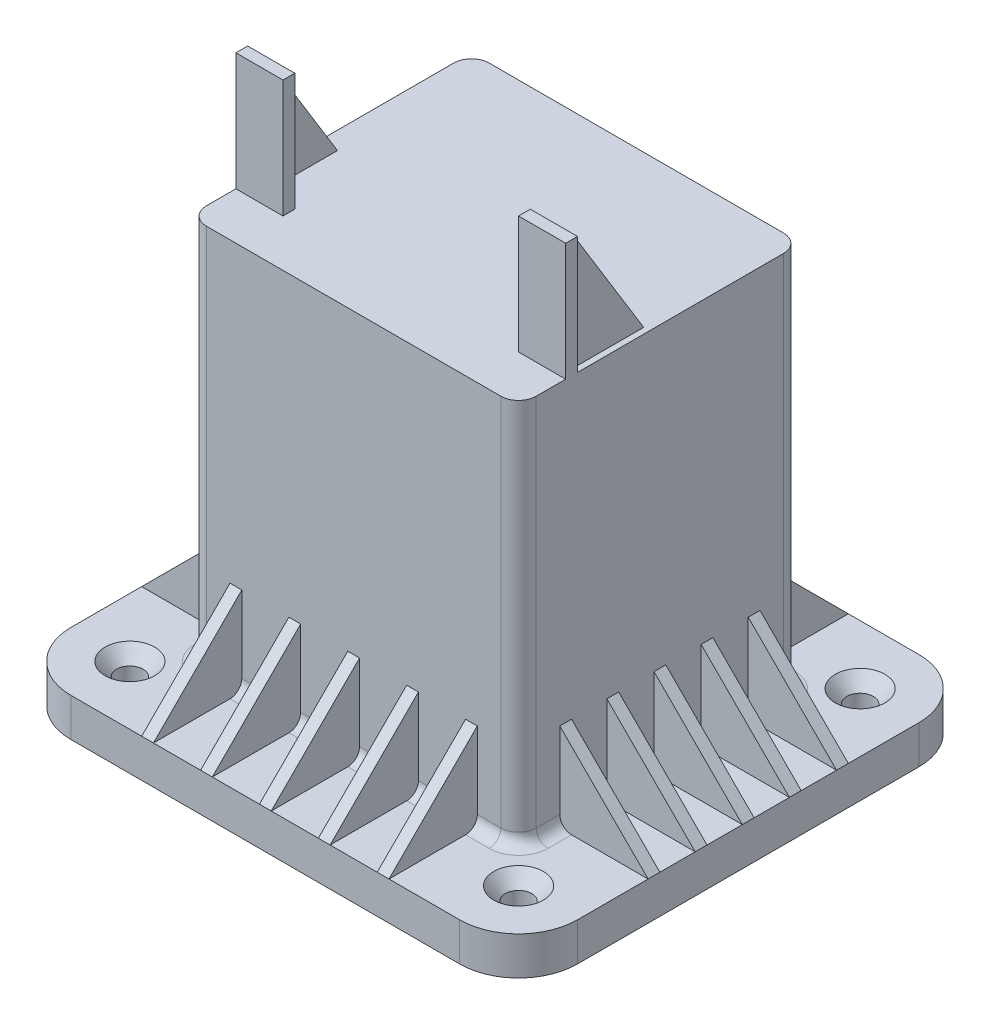
from build123d import *

# Parameters (mm, degrees)
BOSS_EXTRUDE1_DEPTH                            = 8
BOSS_EXTRUDE2_DEPTH                            = 40
SKETCH1_4_W                                    = 8
SKETCH1_4_H                                    = 20
BOSS_EXTRUDE3_DEPTH                            = 2
RIB3_REACH                                     = 72.887
SKETCH3_WALL_W                                 = 167.227880054
SKETCH3_WALL_H                                 = 2
FILLET2_R                                      = 3
BOSS_EXTRUDE4_DEPTH                            = 64
SKETCH5_W                                      = 86
SKETCH5_H                                      = 78
BOSS_EXTRUDE5_DEPTH                            = 6.5
FILLET3_R                                      = 10
CSK_FOR_8_FLAT_HEAD_MACHINE_SCREW1_D           = 4.4958
CSK_FOR_8_FLAT_HEAD_MACHINE_SCREW1_CSINK_D     = 8.4328
CSK_FOR_8_FLAT_HEAD_MACHINE_SCREW1_CSINK_ANGLE = 82
FILLET4_R                                      = 2
RIB4_REACH                                     = 102.29
SKETCH7_WALL_W                                 = 223.792364866
SKETCH7_WALL_H                                 = 2
LPATTERN1_COUNT                                = 3
LPATTERN1_PITCH                                = 10
LPATTERN1_COL_COUNT                            = 3
LPATTERN1_COL_PITCH                            = 10
MIRROR3_COPY_1_REACH                           = 102.29
MIRROR3_COPY_1_SKETCH_W                        = 223.792364866
MIRROR3_COPY_1_SKETCH_H                        = 2
MIRROR3_COPY_2_REACH                           = 102.29
MIRROR3_COPY_2_SKETCH_W                        = 223.792364866
MIRROR3_COPY_2_SKETCH_H                        = 2
MIRROR3_COPY_3_REACH                           = 102.29
MIRROR3_COPY_3_SKETCH_W                        = 223.792364866
MIRROR3_COPY_3_SKETCH_H                        = 2
MIRROR3_COPY_4_REACH                           = 102.29
MIRROR3_COPY_4_SKETCH_W                        = 223.792364866
MIRROR3_COPY_4_SKETCH_H                        = 2
RIB5_REACH                                     = 105.315
SKETCH8_WALL_W                                 = 229.843307728
SKETCH8_WALL_H                                 = 2
LPATTERN2_COUNT                                = 3
LPATTERN2_PITCH                                = 8
LPATTERN2_COL_COUNT                            = 3
LPATTERN2_COL_PITCH                            = 8
MIRROR4_COPY_1_REACH                           = 105.315
MIRROR4_COPY_1_SKETCH_W                        = 229.843307728
MIRROR4_COPY_1_SKETCH_H                        = 2
MIRROR4_COPY_2_REACH                           = 105.315
MIRROR4_COPY_2_SKETCH_W                        = 229.843307728
MIRROR4_COPY_2_SKETCH_H                        = 2
MIRROR4_COPY_3_REACH                           = 105.315
MIRROR4_COPY_3_SKETCH_W                        = 229.843307728
MIRROR4_COPY_3_SKETCH_H                        = 2
MIRROR4_COPY_4_REACH                           = 105.315
MIRROR4_COPY_4_SKETCH_W                        = 229.843307728
MIRROR4_COPY_4_SKETCH_H                        = 2


with BuildPart() as part:
    # Sketch1 → Boss-Extrude1 (new body)
    with BuildSketch(Plane.XY):
        Polygon((40, 0), (0, 0), (-8, 0), (-8, -8), (48, -8), (48, 0), align=None)
    extrude(amount=BOSS_EXTRUDE1_DEPTH)

    # Sketch1<3> → Boss-Extrude2 (add)
    with BuildSketch(Plane.XY):
        Polygon((40, 0), (0, 0), (-8, 0), (-8, -8), (48, -8), (48, 0), align=None)
    extrude(amount=-BOSS_EXTRUDE2_DEPTH)

    # Sketch1<4> → Boss-Extrude3 (add)
    with BuildSketch(Plane.XY):
        with Locations((-4, 10)):
            Rectangle(SKETCH1_4_W, SKETCH1_4_H)
        with Locations((44, 10)):
            Rectangle(SKETCH1_4_W, SKETCH1_4_H)
    extrude(amount=-BOSS_EXTRUDE3_DEPTH)

    # Sketch3 wall → Rib3 (add, up to next)
    with BuildSketch(Plane(origin=(-7, 10, -8.125), x_dir=(0, -0.852754414843, -0.522312079092), z_dir=(0, -0.522312079092, 0.852754414843)), mode=Mode.PRIVATE) as rib3_sk1:
        with Locations((0, 1)):
            Rectangle(SKETCH3_WALL_W, SKETCH3_WALL_H)
    rib3_tool1 = extrude(rib3_sk1.sketch, amount=RIB3_REACH, mode=Mode.PRIVATE) - part.part
    rib3 = rib3_tool1.solids().sort_by_distance((-7, 10, -8.125))[0]
    add(rib3)

    # Mirror2: Rib3 across plane
    add(rib3.mirror(Plane.ZY.offset(-20)))

    # Fillet2
    fillet2_edges = [part.edges().sort_by_distance(p)[0] for p in [
        (-8, -4, 8),
        (-8, -4, -40),
        (48, -4, -40),
        (48, -4, 8),
    ]]
    fillet(fillet2_edges, radius=FILLET2_R)

    # Sketch4 → Boss-Extrude4 (add)
    with BuildSketch(Plane.XZ.offset(8)):
        with BuildLine():
            Line((-5, -40), (45, -40))
            ThreePointArc((45, -40), (47.121320344, -39.121320344), (48, -37))
            Line((48, -37), (48, 5))
            ThreePointArc((48, 5), (47.121320344, 7.121320344), (45, 8))
            Line((45, 8), (-5, 8))
            ThreePointArc((-5, 8), (-7.121320344, 7.121320344), (-8, 5))
            Line((-8, 5), (-8, -37))
            ThreePointArc((-8, -37), (-7.121320344, -39.121320344), (-5, -40))
        make_face()
    extrude(amount=BOSS_EXTRUDE4_DEPTH)

    # Sketch5 → Boss-Extrude5 (add)
    with BuildSketch(Plane.XZ.offset(72)):
        with Locations((20, -16)):
            Rectangle(SKETCH5_W, SKETCH5_H)
    extrude(amount=-BOSS_EXTRUDE5_DEPTH)

    # Fillet3
    fillet3_edges = [part.edges().sort_by_distance(p)[0] for p in [
        (-23, -68.75, -55),
        (-23, -68.75, 23),
        (63, -68.75, 23),
        (63, -68.75, -55),
    ]]
    fillet(fillet3_edges, radius=FILLET3_R)

    # CSK for #8 Flat Head Machine Screw1 (through all)
    with Locations(Plane(origin=(-13, -65.5, 13), x_dir=(1, 0, 0), z_dir=(0, 1, 0))):
        with Locations((0, 0), (0, 58), (66, 0), (66, 58)):
            CounterSinkHole(CSK_FOR_8_FLAT_HEAD_MACHINE_SCREW1_D / 2, CSK_FOR_8_FLAT_HEAD_MACHINE_SCREW1_CSINK_D / 2, counter_sink_angle=CSK_FOR_8_FLAT_HEAD_MACHINE_SCREW1_CSINK_ANGLE)

    # Fillet4
    fillet4_edges = [part.edges().sort_by_distance(p)[0] for p in [
        (-7.121320344, -65.5, -39.121320344),
        (20, -65.5, -40),
        (-8, -65.5, -16),
        (48, -65.5, -16),
        (47.121320344, -65.5, 7.121320344),
        (20, -65.5, 8),
        (-7.121320344, -65.5, 7.121320344),
        (47.121320344, -65.5, -39.121320344),
    ]]
    fillet(fillet4_edges, radius=FILLET4_R)

    # Sketch7 wall → Rib4 (add, up to next)
    with BuildSketch(Plane(origin=(20, -58, -47.5), x_dir=(0, 0.707106781187, 0.707106781187), z_dir=(0, 0.707106781187, -0.707106781187)), mode=Mode.PRIVATE) as rib4_sk1:
        Rectangle(SKETCH7_WALL_W, SKETCH7_WALL_H)
    rib4_tool1 = extrude(rib4_sk1.sketch, amount=-RIB4_REACH, mode=Mode.PRIVATE) - part.part
    rib4 = rib4_tool1.solids().sort_by_distance((20, -58, -47.5))[0]
    add(rib4)

    # LPattern1: Rib4 ×3
    with Locations(*[(-i * LPATTERN1_PITCH, 0, 0) for i in range(1, LPATTERN1_COUNT)]):
        add(rib4)

    # LPattern1 col: Rib4 ×3
    with Locations(*[(i * LPATTERN1_COL_PITCH, 0, 0) for i in range(1, LPATTERN1_COL_COUNT)]):
        add(rib4)

    # Mirror3: Rib4 across plane
    add(rib4.mirror(Plane(origin=(0, 0, -16), x_dir=(1, 0, 0), z_dir=(0, 0, -1))))

    # Mirror3 copy 1 sketch → Mirror3 copy 1 (add, up to next)
    with BuildSketch(Plane(origin=(10, -58, 15.5), x_dir=(0, 0.707106781187, -0.707106781187), z_dir=(0, 0.707106781187, 0.707106781187)), mode=Mode.PRIVATE) as mirror3_copy_1_sk1:
        Rectangle(MIRROR3_COPY_1_SKETCH_W, MIRROR3_COPY_1_SKETCH_H)
    mirror3_copy_1_tool1 = extrude(mirror3_copy_1_sk1.sketch, amount=-MIRROR3_COPY_1_REACH, mode=Mode.PRIVATE) - part.part
    add(mirror3_copy_1_tool1.solids().sort_by_distance((10, -58, 15.5))[0])

    # Mirror3 copy 2 sketch → Mirror3 copy 2 (add, up to next)
    with BuildSketch(Plane(origin=(0, -58, 15.5), x_dir=(0, 0.707106781187, -0.707106781187), z_dir=(0, 0.707106781187, 0.707106781187)), mode=Mode.PRIVATE) as mirror3_copy_2_sk1:
        Rectangle(MIRROR3_COPY_2_SKETCH_W, MIRROR3_COPY_2_SKETCH_H)
    mirror3_copy_2_tool1 = extrude(mirror3_copy_2_sk1.sketch, amount=-MIRROR3_COPY_2_REACH, mode=Mode.PRIVATE) - part.part
    add(mirror3_copy_2_tool1.solids().sort_by_distance((0, -58, 15.5))[0])

    # Mirror3 copy 3 sketch → Mirror3 copy 3 (add, up to next)
    with BuildSketch(Plane(origin=(30, -58, 15.5), x_dir=(0, 0.707106781187, -0.707106781187), z_dir=(0, 0.707106781187, 0.707106781187)), mode=Mode.PRIVATE) as mirror3_copy_3_sk1:
        Rectangle(MIRROR3_COPY_3_SKETCH_W, MIRROR3_COPY_3_SKETCH_H)
    mirror3_copy_3_tool1 = extrude(mirror3_copy_3_sk1.sketch, amount=-MIRROR3_COPY_3_REACH, mode=Mode.PRIVATE) - part.part
    add(mirror3_copy_3_tool1.solids().sort_by_distance((30, -58, 15.5))[0])

    # Mirror3 copy 4 sketch → Mirror3 copy 4 (add, up to next)
    with BuildSketch(Plane(origin=(40, -58, 15.5), x_dir=(0, 0.707106781187, -0.707106781187), z_dir=(0, 0.707106781187, 0.707106781187)), mode=Mode.PRIVATE) as mirror3_copy_4_sk1:
        Rectangle(MIRROR3_COPY_4_SKETCH_W, MIRROR3_COPY_4_SKETCH_H)
    mirror3_copy_4_tool1 = extrude(mirror3_copy_4_sk1.sketch, amount=-MIRROR3_COPY_4_REACH, mode=Mode.PRIVATE) - part.part
    add(mirror3_copy_4_tool1.solids().sort_by_distance((40, -58, 15.5))[0])

    # Sketch8 wall → Rib5 (add, up to next)
    with BuildSketch(Plane(origin=(-15.5, -58, -16), x_dir=(-0.707106781187, -0.707106781187, 0), z_dir=(-0.707106781187, 0.707106781187, 0)), mode=Mode.PRIVATE) as rib5_sk1:
        Rectangle(SKETCH8_WALL_W, SKETCH8_WALL_H)
    rib5_tool1 = extrude(rib5_sk1.sketch, amount=-RIB5_REACH, mode=Mode.PRIVATE) - part.part
    rib5 = rib5_tool1.solids().sort_by_distance((-15.5, -58, -16))[0]
    add(rib5)

    # LPattern2: Rib5 ×3
    with Locations(*[(0, 0, -i * LPATTERN2_PITCH) for i in range(1, LPATTERN2_COUNT)]):
        add(rib5)

    # LPattern2 col: Rib5 ×3
    with Locations(*[(0, 0, i * LPATTERN2_COL_PITCH) for i in range(1, LPATTERN2_COL_COUNT)]):
        add(rib5)

    # Mirror4: Rib5 across plane
    add(rib5.mirror(Plane.ZY.offset(-20)))

    # Mirror4 copy 1 sketch → Mirror4 copy 1 (add, up to next)
    with BuildSketch(Plane(origin=(55.5, -58, -24), x_dir=(0.707106781187, -0.707106781187, 0), z_dir=(0.707106781187, 0.707106781187, 0)), mode=Mode.PRIVATE) as mirror4_copy_1_sk1:
        Rectangle(MIRROR4_COPY_1_SKETCH_W, MIRROR4_COPY_1_SKETCH_H)
    mirror4_copy_1_tool1 = extrude(mirror4_copy_1_sk1.sketch, amount=-MIRROR4_COPY_1_REACH, mode=Mode.PRIVATE) - part.part
    add(mirror4_copy_1_tool1.solids().sort_by_distance((55.5, -58, -24))[0])

    # Mirror4 copy 2 sketch → Mirror4 copy 2 (add, up to next)
    with BuildSketch(Plane(origin=(55.5, -58, -32), x_dir=(0.707106781187, -0.707106781187, 0), z_dir=(0.707106781187, 0.707106781187, 0)), mode=Mode.PRIVATE) as mirror4_copy_2_sk1:
        Rectangle(MIRROR4_COPY_2_SKETCH_W, MIRROR4_COPY_2_SKETCH_H)
    mirror4_copy_2_tool1 = extrude(mirror4_copy_2_sk1.sketch, amount=-MIRROR4_COPY_2_REACH, mode=Mode.PRIVATE) - part.part
    add(mirror4_copy_2_tool1.solids().sort_by_distance((55.5, -58, -32))[0])

    # Mirror4 copy 3 sketch → Mirror4 copy 3 (add, up to next)
    with BuildSketch(Plane(origin=(55.5, -58, -8), x_dir=(0.707106781187, -0.707106781187, 0), z_dir=(0.707106781187, 0.707106781187, 0)), mode=Mode.PRIVATE) as mirror4_copy_3_sk1:
        Rectangle(MIRROR4_COPY_3_SKETCH_W, MIRROR4_COPY_3_SKETCH_H)
    mirror4_copy_3_tool1 = extrude(mirror4_copy_3_sk1.sketch, amount=-MIRROR4_COPY_3_REACH, mode=Mode.PRIVATE) - part.part
    add(mirror4_copy_3_tool1.solids().sort_by_distance((55.5, -58, -8))[0])

    # Mirror4 copy 4 sketch → Mirror4 copy 4 (add, up to next)
    with BuildSketch(Plane(origin=(55.5, -58, 0), x_dir=(0.707106781187, -0.707106781187, 0), z_dir=(0.707106781187, 0.707106781187, 0)), mode=Mode.PRIVATE) as mirror4_copy_4_sk1:
        Rectangle(MIRROR4_COPY_4_SKETCH_W, MIRROR4_COPY_4_SKETCH_H)
    mirror4_copy_4_tool1 = extrude(mirror4_copy_4_sk1.sketch, amount=-MIRROR4_COPY_4_REACH, mode=Mode.PRIVATE) - part.part
    add(mirror4_copy_4_tool1.solids().sort_by_distance((55.5, -58, 0))[0])


solid = part.part
